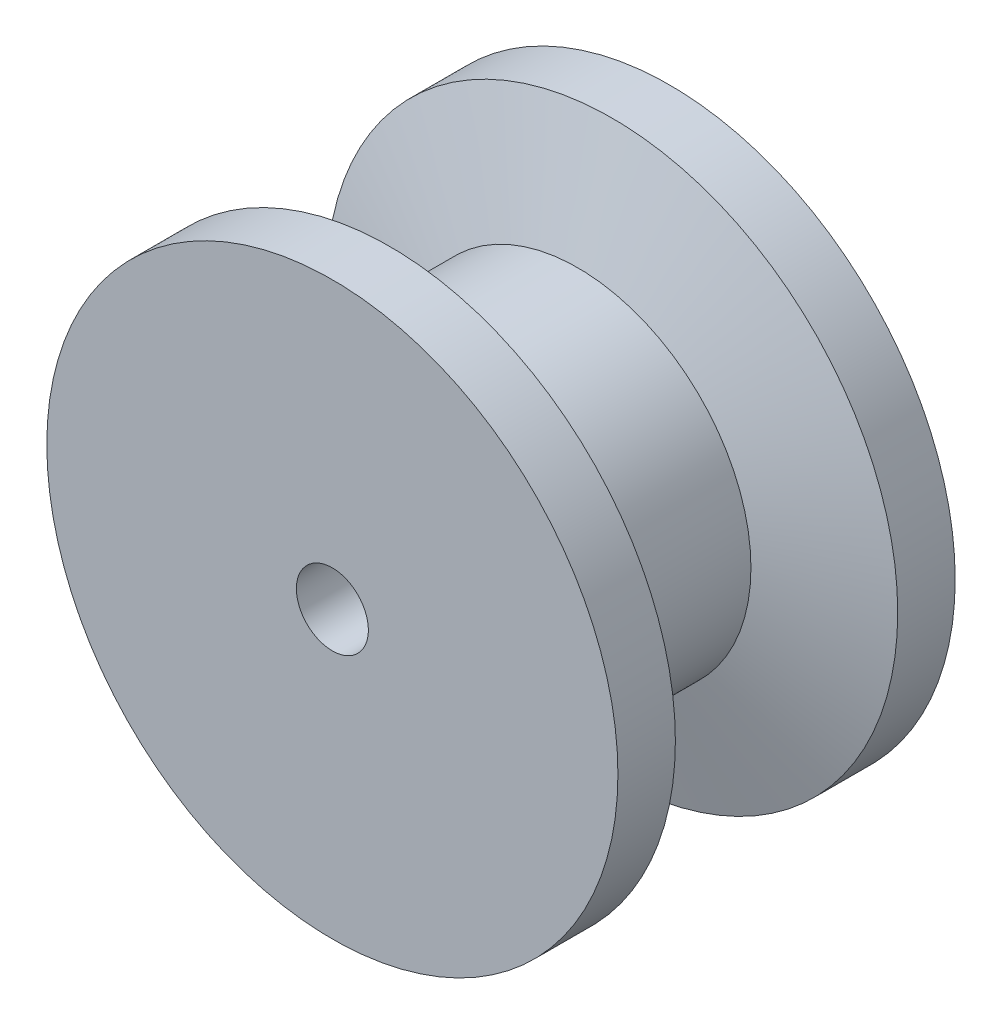
from build123d import *

# Parameters (mm, degrees)
SKETCH3_R          = 2.032
CUT_EXTRUDE1_DEPTH = 30.71854273


with BuildPart() as part:
    # Sketch1 → Revolve1 (revolve)
    with BuildSketch(Plane(origin=(0, 0, 0), x_dir=(0, 0, -1), z_dir=(1, 0, 0)), mode=Mode.PRIVATE) as revolve1_sk:
        Polygon((6.279294914, 16.129), (9.525, 16.129), (9.525, 0), (-9.525, 0), (-9.525, 16.129), (-6.279294914, 16.129), (-4.337905086, 9.779), (4.337905086, 9.779), align=None)
    revolve(revolve1_sk.sketch.rotate(Axis((0, 0, 9.525), (0, 0, -1)), 90), axis=Axis((0, 0, 9.525), (0, 0, -1)))

    # Sketch3 → Cut-Extrude1 (cut, through all)
    with BuildSketch(Plane(origin=(0, 0, -9.525), x_dir=(-1, 0, 0), z_dir=(0, 0, -1))):
        Circle(SKETCH3_R)
    extrude(amount=-CUT_EXTRUDE1_DEPTH, mode=Mode.SUBTRACT)


solid = part.part
